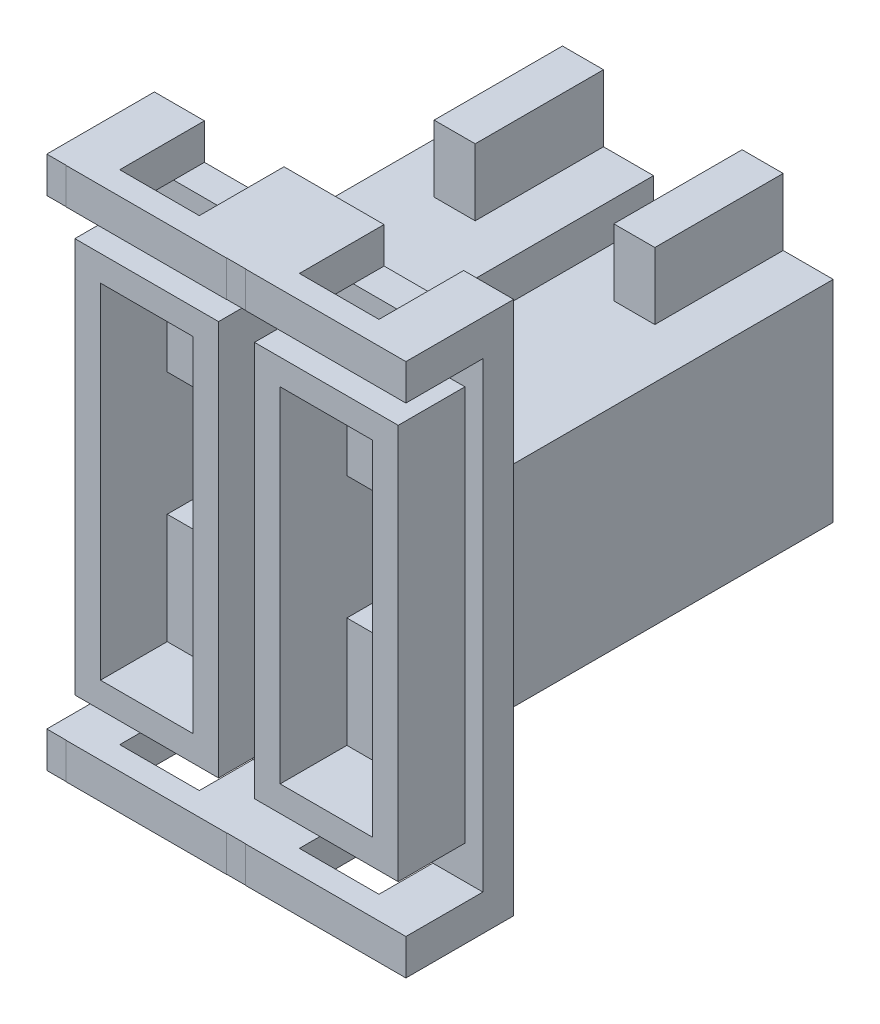
from build123d import *

# Parameters (mm, degrees)
SKETCH_1_W                     = 3.125
SKETCH_1_H                     = 10.4
EXTRUDE_1_DEPTH                = 2.1
CUT_EXTRUDE_1_REACH            = 8.249
SKETCH_2_W                     = 6.25
SKETCH_2_H                     = 9
SKETCH_3_W                     = 1.55
SKETCH_3_H                     = 0.7
CUT_EXTRUDE_2_DEPTH            = 1.05
SKETCH_5_W                     = 1.55
SKETCH_5_H                     = 0.7
CUT_EXTRUDE_4_DEPTH            = 1.05
EXTRUDE_3_DEPTH                = 6.6
SKETCH_9_W                     = 2.8
SKETCH_9_H                     = 7.7
EXTRUDE_4_DEPTH                = 1.3
CUT_EXTRUDE_6_REACH            = 11.424
SKETCH_11_W                    = 1.8
SKETCH_11_H                    = 6.7
CUT_EXTRUDE_9_REACH            = 11.047
SKETCH_14_W                    = 1.8
SKETCH_14_H                    = 2.4
CUT_EXTRUDE_11_REACH           = 14.749
SKETCH_16_W                    = 1.55
SKETCH_16_H                    = 0.6
CUT_EXTRUDE_12_REACH           = 14.749
SKETCH_17_W                    = 1.55
SKETCH_17_H                    = 0.6
EXTRUDE_6_DEPTH                = 0.375
SKETCH_21_W                    = 0.8
SKETCH_21_H                    = 2.5
EXTRUDE_8_DEPTH                = 1.3
HOLE_WIZARD_2_1_2_1_2_D        = 2.1
HOLE_WIZARD_2_1_2_1_2_DEPTH    = 1.2
HOLE_WIZARD_1_2_1_2_1_D        = 1.2
FILLET_1_R                     = 0.4
PATTERN_LINEAR_1_COUNT         = 2
PATTERN_LINEAR_1_PITCH         = 3.5
FILLET_1_OF_PATTERN_LINEAR_1_R = 0.4


with BuildPart() as part:
    # Эскиз1 → Бобышка-Вытянуть1 (new body)
    with BuildSketch(Plane.XY.offset(1.05)):
        with Locations((-1.5625, 0)):
            Rectangle(SKETCH_1_W, SKETCH_1_H)
    extrude_1 = extrude(amount=-EXTRUDE_1_DEPTH)

    # Эскиз2 → Вырез-Вытянуть1 (cut, up to next)
    with BuildSketch(Plane(origin=(0, 0, -0.45), x_dir=(-1, 0, 0), z_dir=(0, 0, -1)), mode=Mode.PRIVATE) as cut_extrude_1_sk1:
        Rectangle(SKETCH_2_W, SKETCH_2_H)
    cut_extrude_1_tool1 = extrude(cut_extrude_1_sk1.sketch, amount=-CUT_EXTRUDE_1_REACH, mode=Mode.PRIVATE) & part.part
    cut_extrude_1 = cut_extrude_1_tool1.solids().sort_by_distance((0, 0, -0.45))[0]
    add(cut_extrude_1, mode=Mode.SUBTRACT)

    # Эскиз3 → Вырез-Вытянуть2 (cut)
    with BuildSketch(Plane(origin=(0, 0, -0.45), x_dir=(-1, 0, 0), z_dir=(0, 0, -1))):
        with Locations((1.75, 4.85)):
            Rectangle(SKETCH_3_W, SKETCH_3_H)
    cut_extrude_2 = extrude(amount=-CUT_EXTRUDE_2_DEPTH, mode=Mode.SUBTRACT)

    # Эскиз5 → Вырез-Вытянуть4 (cut)
    with BuildSketch(Plane(origin=(0, 0, -0.45), x_dir=(-1, 0, 0), z_dir=(0, 0, -1))):
        with Locations((1.75, -4.85)):
            Rectangle(SKETCH_5_W, SKETCH_5_H)
    cut_extrude_4 = extrude(amount=-CUT_EXTRUDE_4_DEPTH, mode=Mode.SUBTRACT)

    # Эскиз8 → Бобышка-Вытянуть3 (add)
    with BuildSketch(Plane(origin=(0, 0, -7.65), x_dir=(-1, 0, 0), z_dir=(0, 0, -1))):
        with BuildLine():
            Line((3.125, 2.05), (0.375, 2.05))
            Line((0.375, 2.05), (0.375, -2.05))
            ThreePointArc((0.375, -2.05), (1.75, -1.502368755), (3.125, -2.05))
            Line((3.125, -2.05), (3.125, 2.05))
        make_face()
    extrude_3 = extrude(amount=-EXTRUDE_3_DEPTH)

    # Эскиз9 → Бобышка-Вытянуть4 (add)
    with BuildSketch(Plane.XY.offset(0.85)):
        with Locations((-1.75, 0)):
            Rectangle(SKETCH_9_W, SKETCH_9_H)
    extrude_4 = extrude(amount=-EXTRUDE_4_DEPTH)

    # Эскиз11 → Вырез-Вытянуть6 (cut, up to next)
    with BuildSketch(Plane(origin=(0, 0, -0.45), x_dir=(-1, 0, 0), z_dir=(0, 0, -1)), mode=Mode.PRIVATE) as cut_extrude_6_sk1:
        with Locations((1.75, 0)):
            Rectangle(SKETCH_11_W, SKETCH_11_H)
    cut_extrude_6_tool1 = extrude(cut_extrude_6_sk1.sketch, amount=-CUT_EXTRUDE_6_REACH, mode=Mode.PRIVATE) & part.part
    cut_extrude_6 = cut_extrude_6_tool1.solids().sort_by_distance((-1.75, 0, -0.45))[0]
    add(cut_extrude_6, mode=Mode.SUBTRACT)

    # Эскиз14 → Вырез-Вытянуть9 (cut, up to next)
    with BuildSketch(Plane(origin=(0, 0, -5.65), x_dir=(-1, 0, 0), z_dir=(0, 0, -1)), mode=Mode.PRIVATE) as cut_extrude_9_sk1:
        with Locations((1.75, 0)):
            Rectangle(SKETCH_14_W, SKETCH_14_H)
    cut_extrude_9_tool1 = extrude(cut_extrude_9_sk1.sketch, amount=-CUT_EXTRUDE_9_REACH, mode=Mode.PRIVATE) & part.part
    cut_extrude_9 = cut_extrude_9_tool1.solids().sort_by_distance((-1.75, 0, -5.65))[0]
    add(cut_extrude_9, mode=Mode.SUBTRACT)

    # Эскиз16 → Вырез-Вытянуть11 (cut, up to next)
    with BuildSketch(Plane(origin=(0, -4.5, 0), x_dir=(1, 0, 0), z_dir=(0, 1, 0)), mode=Mode.PRIVATE) as cut_extrude_11_sk1:
        with Locations((-1.75, 0.75)):
            Rectangle(SKETCH_16_W, SKETCH_16_H)
    cut_extrude_11_tool1 = extrude(cut_extrude_11_sk1.sketch, amount=-CUT_EXTRUDE_11_REACH, mode=Mode.PRIVATE) & part.part
    cut_extrude_11 = cut_extrude_11_tool1.solids().sort_by_distance((-1.75, -4.5, -0.75))[0]
    add(cut_extrude_11, mode=Mode.SUBTRACT)

    # Эскиз17 → Вырез-Вытянуть12 (cut, up to next)
    with BuildSketch(Plane.XZ.offset(-4.5), mode=Mode.PRIVATE) as cut_extrude_12_sk1:
        with Locations((-1.75, -0.75)):
            Rectangle(SKETCH_17_W, SKETCH_17_H)
    cut_extrude_12_tool1 = extrude(cut_extrude_12_sk1.sketch, amount=-CUT_EXTRUDE_12_REACH, mode=Mode.PRIVATE) & part.part
    cut_extrude_12 = cut_extrude_12_tool1.solids().sort_by_distance((-1.75, 4.5, -0.75))[0]
    add(cut_extrude_12, mode=Mode.SUBTRACT)

    # Эскиз19 → Бобышка-Вытянуть6 (add)
    with BuildSketch(Plane(origin=(-3.5, 0, 0), x_dir=(0, -1, 0), z_dir=(-1, 0, 0))):
        Polygon((1.65, -1.05), (5.2, -1.05), (5.2, 1.046361901), (4.5, 1.046361901), (4.5, -0.453638099), (-4.5, -0.453638099), (-4.5, 1.046361901), (-5.2, 1.046361901), (-5.2, -1.05), align=None)
    extrude_6 = extrude(amount=-EXTRUDE_6_DEPTH)

    # Эскиз21 → Бобышка-Вытянуть8 (add)
    with BuildSketch(Plane(origin=(0, 3.35, 0), x_dir=(1, 0, 0), z_dir=(0, 1, 0))):
        with Locations((-1.75, 6.4)):
            Rectangle(SKETCH_21_W, SKETCH_21_H)
    extrude_8 = extrude(amount=-EXTRUDE_8_DEPTH)

    # Диаметр отверстия Ø2.1 (2.1)2
    with Locations(Plane(origin=(0, 0, -7.65), x_dir=(-1, 0, 0), z_dir=(0, 0, -1))):
        with Locations((1.75, 0)):
            hole_wizard_2_1_2_1_2 = Hole(HOLE_WIZARD_2_1_2_1_2_D / 2, depth=HOLE_WIZARD_2_1_2_1_2_DEPTH)

    # Диаметр отверстия Ø1.2 (1.2)1 (through all)
    with Locations(Plane.XY.offset(-5.65)):
        with Locations((-1.75, 0)):
            hole_wizard_1_2_1_2_1 = Hole(HOLE_WIZARD_1_2_1_2_1_D / 2)

    # Скругление1
    fillet_1_edges = [part.edges().sort_by_distance(p)[0] for p in [
        (-2.8, 0, -6.45),
    ]]
    fillet(fillet_1_edges, radius=FILLET_1_R)

    # Линейный массив1: Бобышка-Вытянуть1, Вырез-Вытянуть1, Вырез-Вытянуть2, Вырез-Вытянуть4, Бобышка-Вытянуть3, Бобышка-Вытянуть4, Вырез-Вытянуть6, Вырез-Вытянуть9, Вырез-Вытянуть11, Вырез-Вытянуть12, Бобышка-Вытянуть6, Бобышка-Вытянуть8, Диаметр отверстия Ø2.1 (2.1)2, Диаметр отверстия Ø1.2 (1.2)1 ×2
    with Locations(*[(-i * PATTERN_LINEAR_1_PITCH, 0, 0) for i in range(1, PATTERN_LINEAR_1_COUNT)]):
        add(extrude_1)
        add(cut_extrude_1, mode=Mode.SUBTRACT)
        add(cut_extrude_2, mode=Mode.SUBTRACT)
        add(cut_extrude_4, mode=Mode.SUBTRACT)
        add(extrude_3)
        add(extrude_4)
        add(cut_extrude_6, mode=Mode.SUBTRACT)
        add(cut_extrude_9, mode=Mode.SUBTRACT)
        add(cut_extrude_11, mode=Mode.SUBTRACT)
        add(cut_extrude_12, mode=Mode.SUBTRACT)
        add(extrude_6)
        add(extrude_8)
        add(hole_wizard_2_1_2_1_2, mode=Mode.SUBTRACT)
        add(hole_wizard_1_2_1_2_1, mode=Mode.SUBTRACT)

    # Скругление1 of Линейный массив1
    fillet_1_of_pattern_linear_1_edges = [part.edges().sort_by_distance(p)[0] for p in [
        (-6.3, 0, -6.45),
    ]]
    fillet(fillet_1_of_pattern_linear_1_edges, radius=FILLET_1_OF_PATTERN_LINEAR_1_R)


solid = part.part
